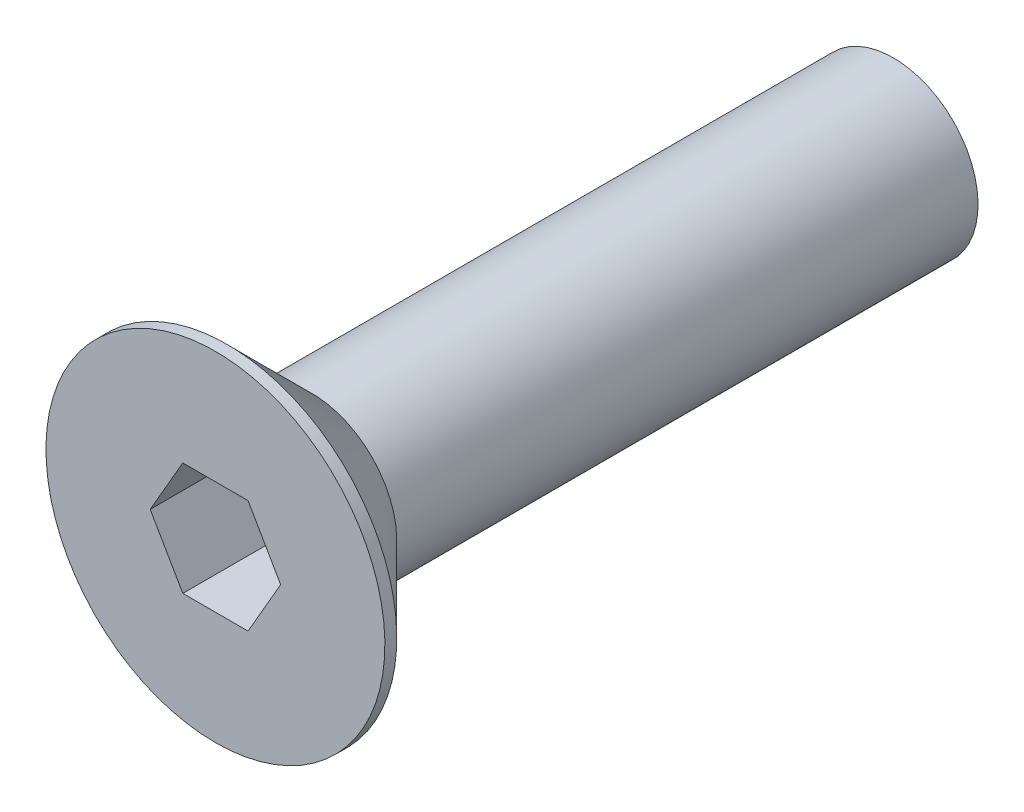
from build123d import *

# Parameters (mm, degrees)
CUT_EXTRUDE1_DEPTH = 1.5


with BuildPart() as part:
    # Sketch1 → Revolve1 (revolve)
    with BuildSketch(Plane(origin=(0, 0, 0), x_dir=(0, 0, -1), z_dir=(1, 0, 0))):
        Polygon((-1.7, 0), (-1.7, 3), (-1.49, 3), (0, 1.51), (0, 1.5), (10.3, 1.5), (10.3, 0), align=None)
    revolve(axis=Axis((0, 0, 5.584882278), (0, 0, -1)))

    # Sketch2 → Cut-Extrude1 (cut)
    with BuildSketch(Plane.XY.offset(1.7)):
        Polygon((0.577350269, -1), (1.154700538, 0), (0.577350269, 1), (-0.577350269, 1), (-1.154700538, 0), (-0.577350269, -1), align=None)
    extrude(amount=-CUT_EXTRUDE1_DEPTH, mode=Mode.SUBTRACT)


solid = part.part
